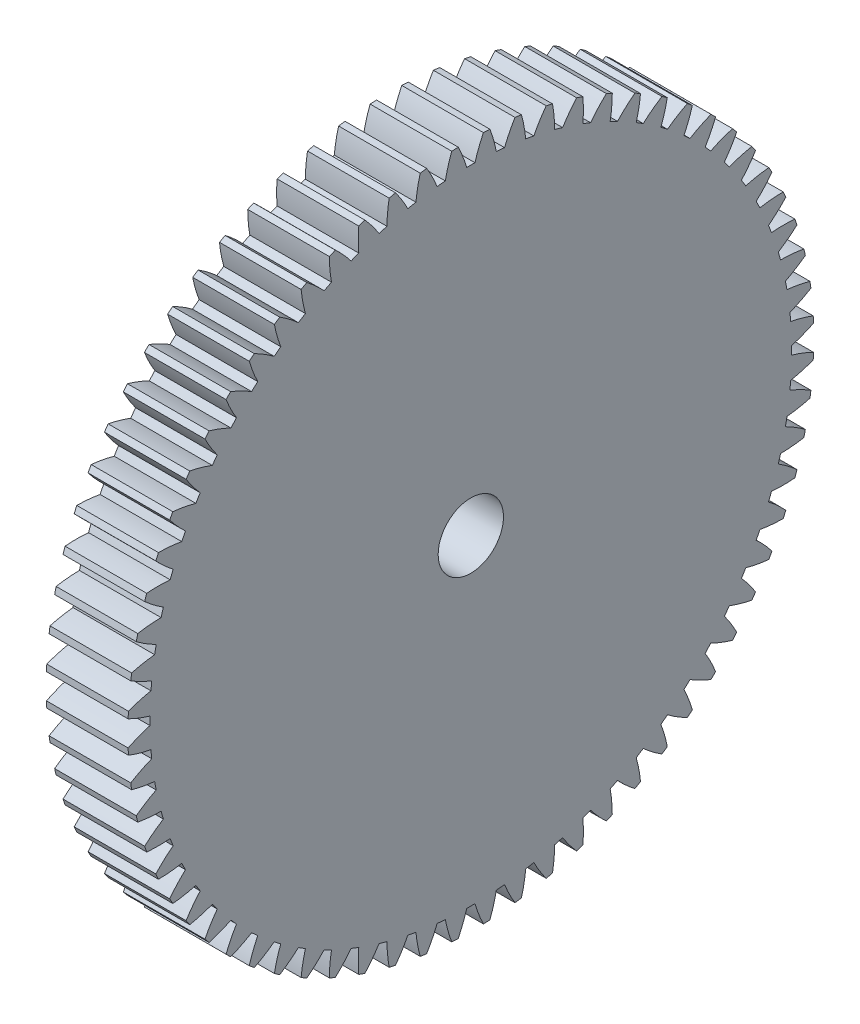
from build123d import *

# Parameters (mm, degrees)
BASPROSKE_W     = 25
BASPROSKE_H     = 105
TOOTHCUT_DEPTH  = 151.582203464
TEETHCUTS_COUNT = 68
TEETHCUTS_ANGLE = 354.705882353
BORSKE_R        = 10
BORE_DEPTH      = 50.0000508


with BuildPart() as part:
    # BasProSke → Base-Revolve (revolve)
    with BuildSketch(Plane(origin=(0, 0, 0), x_dir=(1, 0, 0), z_dir=(0, 1, 0)), mode=Mode.PRIVATE) as base_revolve_sk:
        with Locations((12.5, 52.5)):
            Rectangle(BASPROSKE_W, BASPROSKE_H)
    revolve(base_revolve_sk.sketch.rotate(Axis((-10, 0, 0), (1, 0, 0)), 180), axis=Axis((-10, 0, 0), (1, 0, 0)))

    # TooCutSke → ToothCut (cut, through all)
    with BuildSketch(Plane(origin=(0, 0, 0), x_dir=(0, 0, -1), z_dir=(1, 0, 0))):
        with BuildLine():
            ThreePointArc((1.265772591, 98.24084599), (0, 98.249), (-1.265772591, 98.24084599))
            ThreePointArc((-1.265772591, 98.24084599), (-2.420154849, 101.655032298), (-3.871330635, 104.954025384))
            ThreePointArc((-3.871330635, 104.954025384), (0, 105.0254), (3.871330635, 104.954025384))
            ThreePointArc((3.871330635, 104.954025384), (2.420154849, 101.655032298), (1.265772591, 98.24084599))
        make_face()
    toothcut = extrude(amount=TOOTHCUT_DEPTH, mode=Mode.SUBTRACT)

    # TeethCuts: ToothCut ×68 about axis
    teethcuts_axis = Axis((-10, 0, 0), (1, 0, 0))
    for i in range(1, TEETHCUTS_COUNT):
        add(toothcut.rotate(teethcuts_axis, i * TEETHCUTS_ANGLE / (TEETHCUTS_COUNT - 1)), mode=Mode.SUBTRACT)

    # BorSke → Bore (cut, symmetric)
    with BuildSketch(Plane(origin=(0, 0, 0), x_dir=(0, 0, -1), z_dir=(1, 0, 0))):
        with Locations(Location((0, 0, 0), (0, 0, 180))):
            Circle(BORSKE_R)
    extrude(amount=BORE_DEPTH, both=True, mode=Mode.SUBTRACT)


solid = part.part
